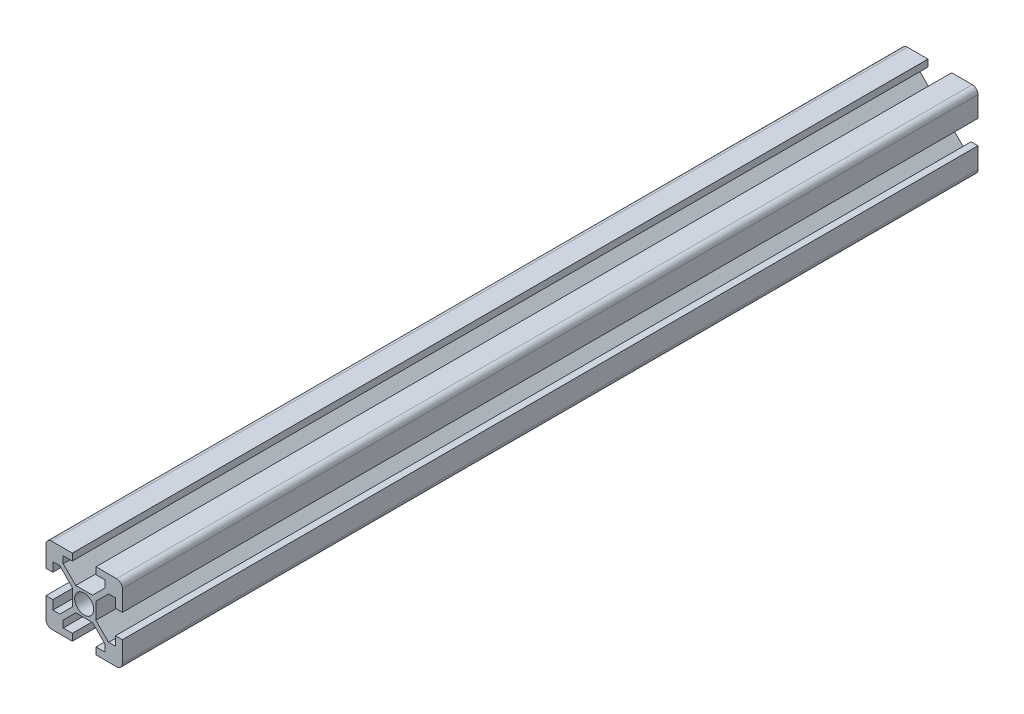
from build123d import *

# Parameters (mm, degrees)
SKETCH_1_R          = 2.5
EXTRUDE_1_DEPTH     = 950
SKETCH_2_W          = 109.948268043
SKETCH_2_H          = 29.443949836
CUT_EXTRUDE_1_DEPTH = 725.86


with BuildPart() as part:
    # 草图1 → 凸台-拉伸1 (new body)
    with BuildSketch(Plane.XY):
        with BuildLine():
            Line((-8.2, -3.1), (-10, -3.1))
            Line((-10, -3.1), (-10, -8.5))
            ThreePointArc((-10, -8.5), (-9.560660172, -9.560660172), (-8.5, -10))
            Line((-8.5, -10), (-3.1, -10))
            Line((-3.1, -10), (-3.1, -8.2))
            Line((-3.1, -8.2), (-5.5, -8.2))
            Line((-5.5, -8.2), (-5.5, -6.397050155))
            Line((-5.5, -6.397050155), (-2.202949845, -3.1))
            Line((-2.202949845, -3.1), (2.202949845, -3.1))
            Line((2.202949845, -3.1), (5.5, -6.397050155))
            Line((5.5, -6.397050155), (5.5, -8.2))
            Line((5.5, -8.2), (3.1, -8.2))
            Line((3.1, -8.2), (3.1, -10))
            Line((3.1, -10), (8.5, -10))
            ThreePointArc((8.5, -10), (9.560660172, -9.560660172), (10, -8.5))
            Line((10, -8.5), (10, -3.1))
            Line((10, -3.1), (8.2, -3.1))
            Line((8.2, -3.1), (8.2, -5.5))
            Line((8.2, -5.5), (6.397050155, -5.5))
            Line((6.397050155, -5.5), (3.05412702, -2.157076865))
            Line((3.05412702, -2.157076865), (3.05412702, 2.157076865))
            Line((3.05412702, 2.157076865), (6.397050155, 5.5))
            Line((6.397050155, 5.5), (8.2, 5.5))
            Line((8.2, 5.5), (8.2, 3.1))
            Line((8.2, 3.1), (10, 3.1))
            Line((10, 3.1), (10, 8.5))
            ThreePointArc((10, 8.5), (9.560660172, 9.560660172), (8.5, 10))
            Line((8.5, 10), (3.1, 10))
            Line((3.1, 10), (3.1, 8.2))
            Line((3.1, 8.2), (5.5, 8.2))
            Line((5.5, 8.2), (5.5, 6.397050155))
            Line((5.5, 6.397050155), (2.202949845, 3.1))
            Line((2.202949845, 3.1), (-2.202949845, 3.1))
            Line((-2.202949845, 3.1), (-5.5, 6.397050155))
            Line((-5.5, 6.397050155), (-5.5, 8.2))
            Line((-5.5, 8.2), (-3.1, 8.2))
            Line((-3.1, 8.2), (-3.1, 10))
            Line((-3.1, 10), (-8.5, 10))
            ThreePointArc((-8.5, 10), (-9.560660172, 9.560660172), (-10, 8.5))
            Line((-10, 8.5), (-10, 3.1))
            Line((-10, 3.1), (-8.2, 3.1))
            Line((-8.2, 3.1), (-8.2, 5.5))
            Line((-8.2, 5.5), (-6.397050155, 5.5))
            Line((-6.397050155, 5.5), (-3.05412702, 2.157076865))
            Line((-3.05412702, 2.157076865), (-3.05412702, -2.157076865))
            Line((-3.05412702, -2.157076865), (-6.397050155, -5.5))
            Line((-6.397050155, -5.5), (-8.2, -5.5))
            Line((-8.2, -5.5), (-8.2, -3.1))
        make_face()
        with Locations(Location((0, 0, 0), (0, 0, 180))):
            Circle(SKETCH_1_R, mode=Mode.SUBTRACT)
    extrude(amount=EXTRUDE_1_DEPTH)

    # 草图2 → 切除-拉伸1 (cut)
    with BuildSketch(Plane.XY.offset(950)):
        with Locations((27.511129311, -2.182282155)):
            Rectangle(SKETCH_2_W, SKETCH_2_H)
    extrude(amount=-CUT_EXTRUDE_1_DEPTH, mode=Mode.SUBTRACT)


solid = part.part
